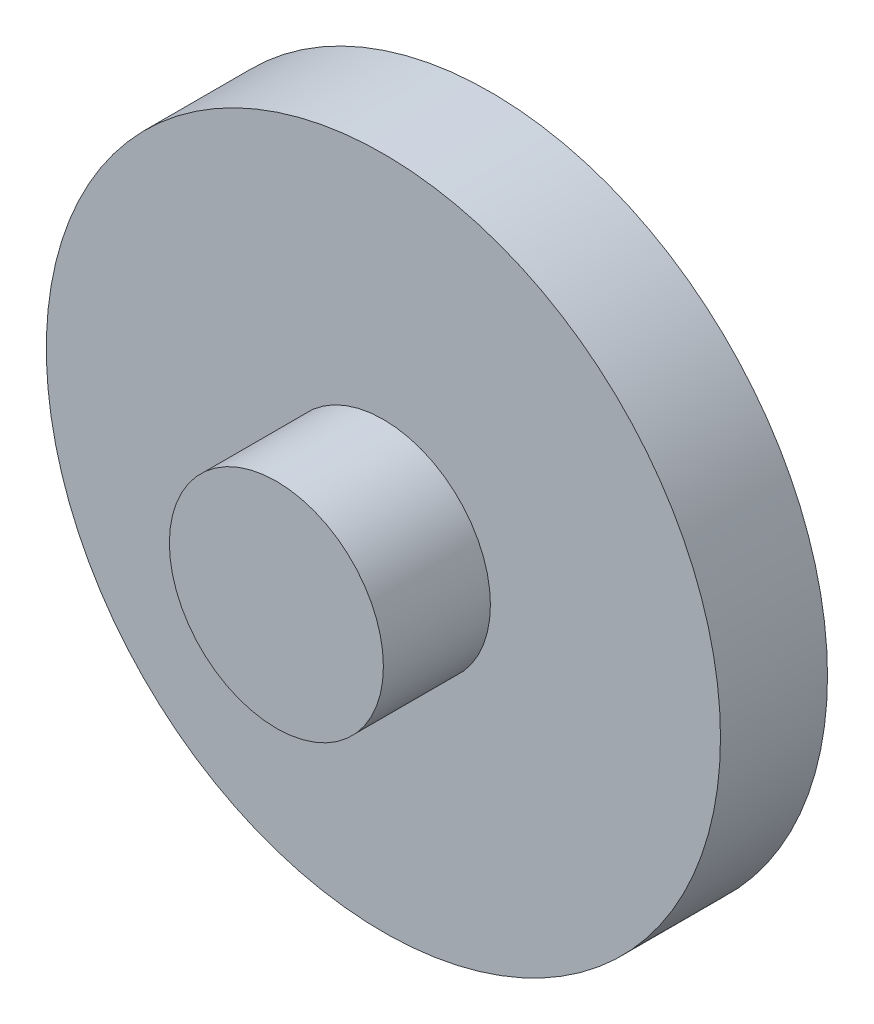
from build123d import *

# Parameters (mm, degrees)
SKETCH1_R           = 15.75
SKETCH1_R_2         = 5
BOSS_EXTRUDE1_DEPTH = 5
SKETCH1_2_R         = 5
BOSS_EXTRUDE2_DEPTH = 10


with BuildPart() as part:
    # Sketch1 → Boss-Extrude1 (new body)
    with BuildSketch(Plane.XY):
        Circle(SKETCH1_R)
        Circle(SKETCH1_R_2, mode=Mode.SUBTRACT)
    extrude(amount=BOSS_EXTRUDE1_DEPTH)

    # Sketch1<2> → Boss-Extrude2 (add)
    with BuildSketch(Plane.XY):
        Circle(SKETCH1_2_R)
    extrude(amount=BOSS_EXTRUDE2_DEPTH)


solid = part.part
